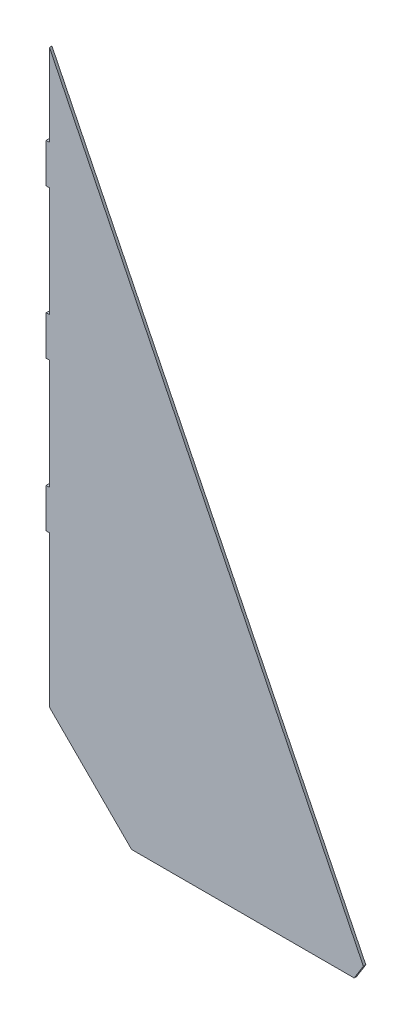
from build123d import *

# Parameters (mm, degrees)
BOSS_EXTRUDE1_DEPTH = 1.5
SKETCH7_W           = 1.5
SKETCH7_H           = 24
BOSS_EXTRUDE3_DEPTH = 2


with BuildPart() as part:
    # Sketch1 → Boss-Extrude1 (new body)
    with BuildSketch(Plane.XY):
        Polygon((0, 0), (0, 297.863160558), (191.093722223, -91.025013327), (185.5038939, -100), (50, -100), (0, -50), align=None)
    extrude(amount=BOSS_EXTRUDE1_DEPTH)

    # Sketch7 → Boss-Extrude3 (add)
    with BuildSketch(Plane.ZY):
        with Locations((0.75, 235.863160558)):
            Rectangle(SKETCH7_W, SKETCH7_H)
        with Locations((0.75, 144.983352075)):
            Rectangle(SKETCH7_W, SKETCH7_H)
        with Locations((0.75, 53.983352075)):
            Rectangle(SKETCH7_W, SKETCH7_H)
    extrude(amount=BOSS_EXTRUDE3_DEPTH)


solid = part.part
